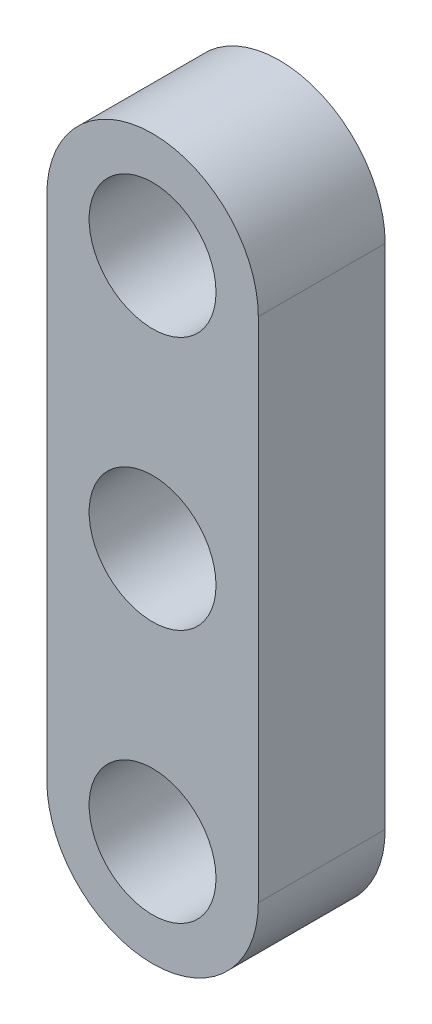
from build123d import *

# Parameters (mm, degrees)
ESQUISSE2_R        = 1.5
BOSS_EXTRU_1_DEPTH = 3


with BuildPart() as part:
    # Esquisse2 → Boss.-Extru.1 (new body)
    with BuildSketch(Plane.XY.offset(-3.51798097)):
        with BuildLine():
            Line((25, 4), (25, 16))
            ThreePointArc((25, 16), (27.5, 18.5), (30, 16))
            Line((30, 16), (30, 4))
            ThreePointArc((30, 4), (27.5, 1.5), (25, 4))
        make_face()
        with Locations((27.5, 16)):
            Circle(ESQUISSE2_R, mode=Mode.SUBTRACT)
        with Locations((27.5, 4)):
            Circle(ESQUISSE2_R, mode=Mode.SUBTRACT)
        with Locations((27.5, 10)):
            Circle(ESQUISSE2_R, mode=Mode.SUBTRACT)
    extrude(amount=BOSS_EXTRU_1_DEPTH)


solid = part.part
